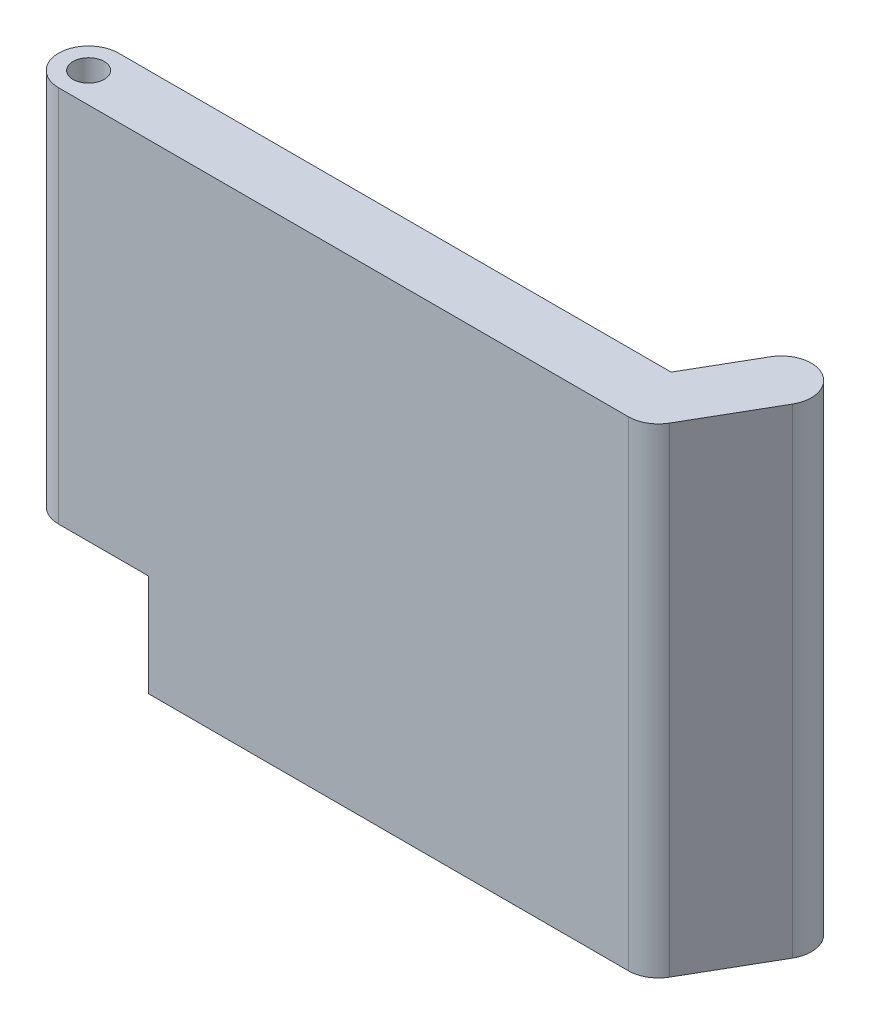
from build123d import *

# Parameters (mm, degrees)
SKETCH1_R           = 3.302
BOSS_EXTRUDE1_DEPTH = 101.6
SKETCH2_W           = 25.4
SKETCH2_H           = 21.59
CUT_EXTRUDE1_DEPTH  = 173.667733558


with BuildPart() as part:
    # Sketch1 → Boss-Extrude1 (new body)
    with BuildSketch(Plane(origin=(0, 0, 0), x_dir=(1, 0, 0), z_dir=(0, 1, 0))):
        with BuildLine():
            Line((116.983825791, 6.35), (0, 6.35))
            ThreePointArc((0, 6.35), (-6.35, 0), (0, -6.35))
            Line((0, -6.35), (120.65, -6.35))
            ThreePointArc((120.65, -6.35), (123.825, -5.499261314), (126.149261314, -3.175))
            Line((126.149261314, -3.175), (135.674261314, 13.322783942))
            ThreePointArc((135.674261314, 13.322783942), (133.35, 21.997045256), (124.675738686, 19.672783942))
            Line((124.675738686, 19.672783942), (116.983825791, 6.35))
        make_face()
        Circle(SKETCH1_R, mode=Mode.SUBTRACT)
    extrude(amount=BOSS_EXTRUDE1_DEPTH)

    # Sketch2 → Cut-Extrude1 (cut, through all)
    with BuildSketch(Plane.XY.offset(6.35)):
        with Locations((6.35, 10.795)):
            Rectangle(SKETCH2_W, SKETCH2_H)
    extrude(amount=-CUT_EXTRUDE1_DEPTH, mode=Mode.SUBTRACT)


solid = part.part
